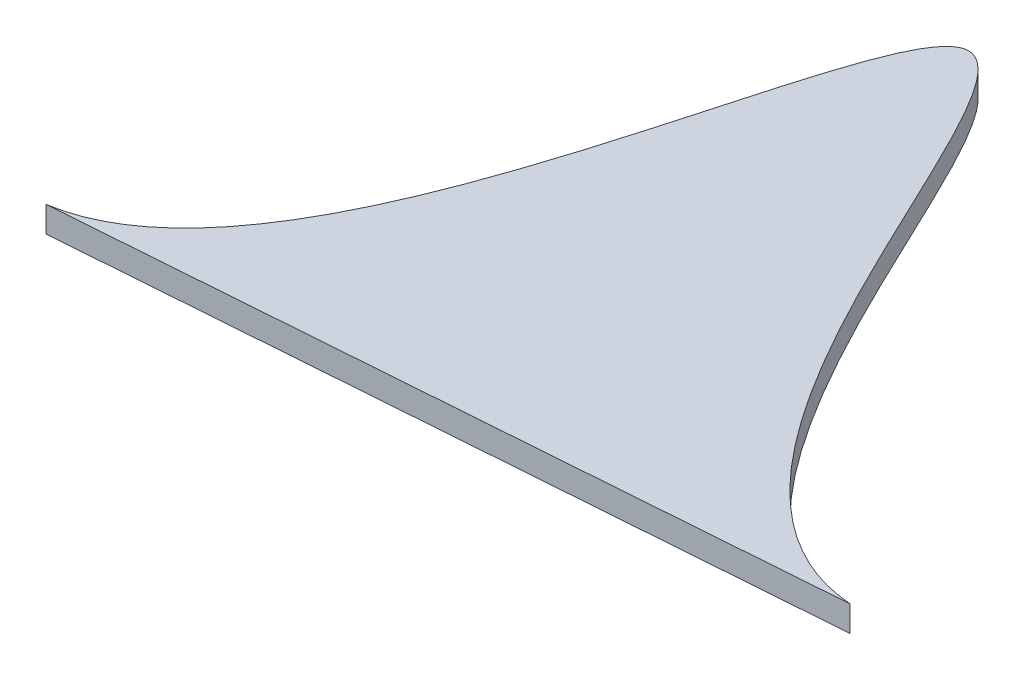
from build123d import *

# Parameters (mm, degrees)
BOSS_EXTRUDE1_DEPTH = 2.5


with BuildPart() as part:
    # Sketch1 → Boss-Extrude1 (new, symmetric)
    with BuildSketch(Plane(origin=(0, 0, 0), x_dir=(1, 0, 0), z_dir=(0, 1, 0))):
        with BuildLine():
            add(Edge.make_bspline(
                [(4.509676905, 0.338292783), (47.703012448, 7.106723924), (59.193899858, 221.073696506), (105.975334824, 14.319665249), (150, 11.252229051)],
                knots=[0.016472138, 0.016472138, 0.016472138, 0.016472138, 0.503858774, 1, 1, 1, 1], degree=3))
            Line((4.509676905, 0.338292783), (150, 11.252229051))
        make_face()
    extrude(amount=BOSS_EXTRUDE1_DEPTH, both=True)


solid = part.part
